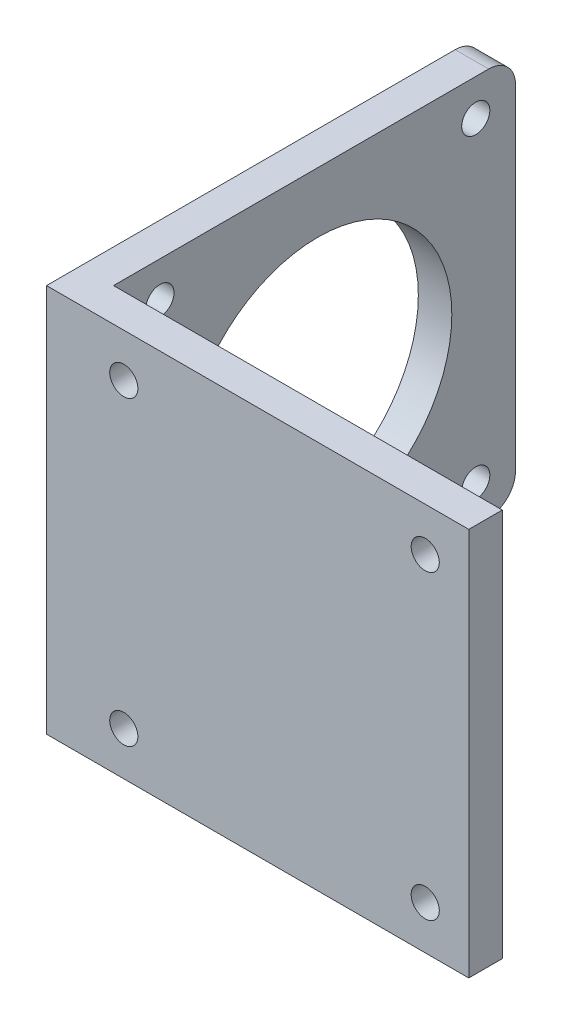
from build123d import *

# Parameters (mm, degrees)
BOSS_EXTRUDE2_DEPTH   = 58
SKETCH3_R             = 20
CUT_EXTRUDE3_DEPTH    = 105.673761331
M5X0_8_TAPPED_HOLE3_D = 4.2
M5X0_8_TAPPED_HOLE2_D = 4.2
FILLET1_R             = 4


with BuildPart() as part:
    # Sketch2 → Boss-Extrude2 (new body)
    with BuildSketch(Plane(origin=(0, 0, 0), x_dir=(1, 0, 0), z_dir=(0, 1, 0))):
        Polygon((0, 0), (0, 65), (5, 65), (5, 5), (63.030994401, 5), (63.030994401, 0), align=None)
    extrude(amount=BOSS_EXTRUDE2_DEPTH)

    # Sketch3 → Cut-Extrude3 (cut, through all)
    with BuildSketch(Plane.ZY.offset(-5)):
        with Locations((-35.5, 29)):
            Circle(SKETCH3_R)
    extrude(amount=CUT_EXTRUDE3_DEPTH, mode=Mode.SUBTRACT)

    # M5x0.8 Tapped Hole3 (through all)
    with Locations(Plane.XY):
        with Locations((11.530994401, 6.5), (11.530994401, 51.5), (56.530994401, 51.5), (56.530994401, 6.5)):
            Hole(M5X0_8_TAPPED_HOLE3_D / 2)

    # M5x0.8 Tapped Hole2 (through all)
    with Locations(Plane.ZY):
        with Locations((-11.926827682, 5.426827682), (-11.926827682, 52.573172318), (-59.073172318, 52.573172318), (-59.073172318, 5.426827682)):
            Hole(M5X0_8_TAPPED_HOLE2_D / 2)

    # Fillet1
    fillet1_edges = [part.edges().sort_by_distance(p)[0] for p in [
        (2.5, 58, -65),
        (2.5, 0, -65),
    ]]
    fillet(fillet1_edges, radius=FILLET1_R)


solid = part.part
